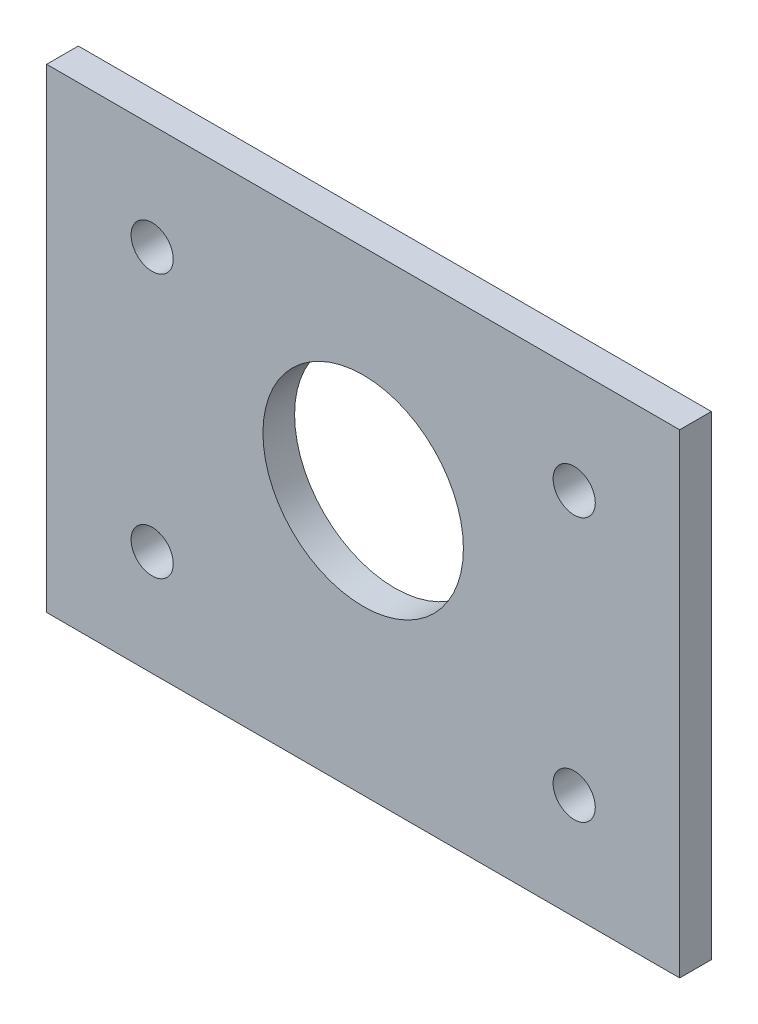
from build123d import *

# Parameters (mm, degrees)
SKETCH_1_R      = 2
SKETCH_1_R_2    = 9.5
EXTRUDE_2_DEPTH = 1.5


with BuildPart() as part:
    # 草图1 → 凸台-拉伸2 (new, symmetric)
    # profile 1 of 2: a face of its own
    with BuildSketch(Plane.XY):
        with BuildLine():
            Line((-30, 12.5), (-30, -22.5))
            Line((-30, -22.5), (30, -22.5))
            Line((30, -22.5), (30, 22.5))
            Line((30, 22.5), (-20, 22.5))
            Line((-20, 22.5), (-20, 14.5))
            ThreePointArc((-20, 14.5), (-18.585786438, 13.914213562), (-18, 12.5))
            ThreePointArc((-18, 12.5), (-20, 10.5), (-22, 12.5))
            Line((-22, 12.5), (-30, 12.5))
        make_face()
        with Locations((-20, -12.5)):
            Circle(SKETCH_1_R, mode=Mode.SUBTRACT)
        with Locations((20, -12.5)):
            Circle(SKETCH_1_R, mode=Mode.SUBTRACT)
        with Locations((0, 2.5)):
            Circle(SKETCH_1_R_2, mode=Mode.SUBTRACT)
        with Locations((20, 12.5)):
            Circle(SKETCH_1_R, mode=Mode.SUBTRACT)
    # profile 2 of 2: a face of its own
    with BuildSketch(Plane.XY):
        with BuildLine():
            Line((-30, 22.5), (-30, 12.5))
            Line((-30, 12.5), (-22, 12.5))
            ThreePointArc((-22, 12.5), (-21.414213562, 13.914213562), (-20, 14.5))
            Line((-20, 14.5), (-20, 22.5))
            Line((-20, 22.5), (-30, 22.5))
        make_face()
    extrude(amount=EXTRUDE_2_DEPTH, both=True)


solid = part.part
